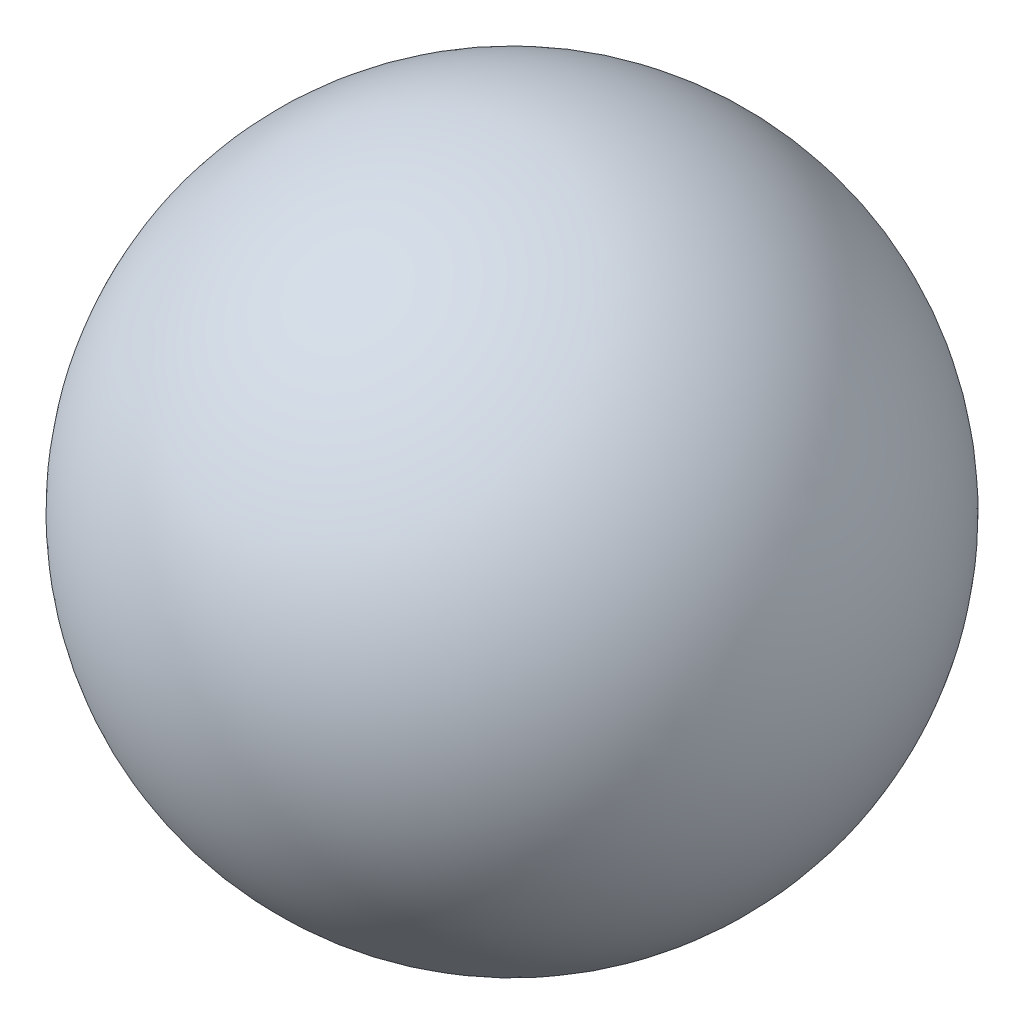
from build123d import *


with BuildPart() as part:
    # Esquisse1 → Base-Révolution (revolve)
    with BuildSketch(Plane(origin=(0, 0, 0), x_dir=(1, 0, 0), z_dir=(0, 1, 0))):
        with BuildLine():
            Line((2.1, 4.9), (8.7, 4.9))
            ThreePointArc((8.7, 4.9), (5.4, 8.2), (2.1, 4.9))
        make_face()
    revolve(axis=Axis((-0.6, 0, -4.9), (1, 0, 0)))


solid = part.part
